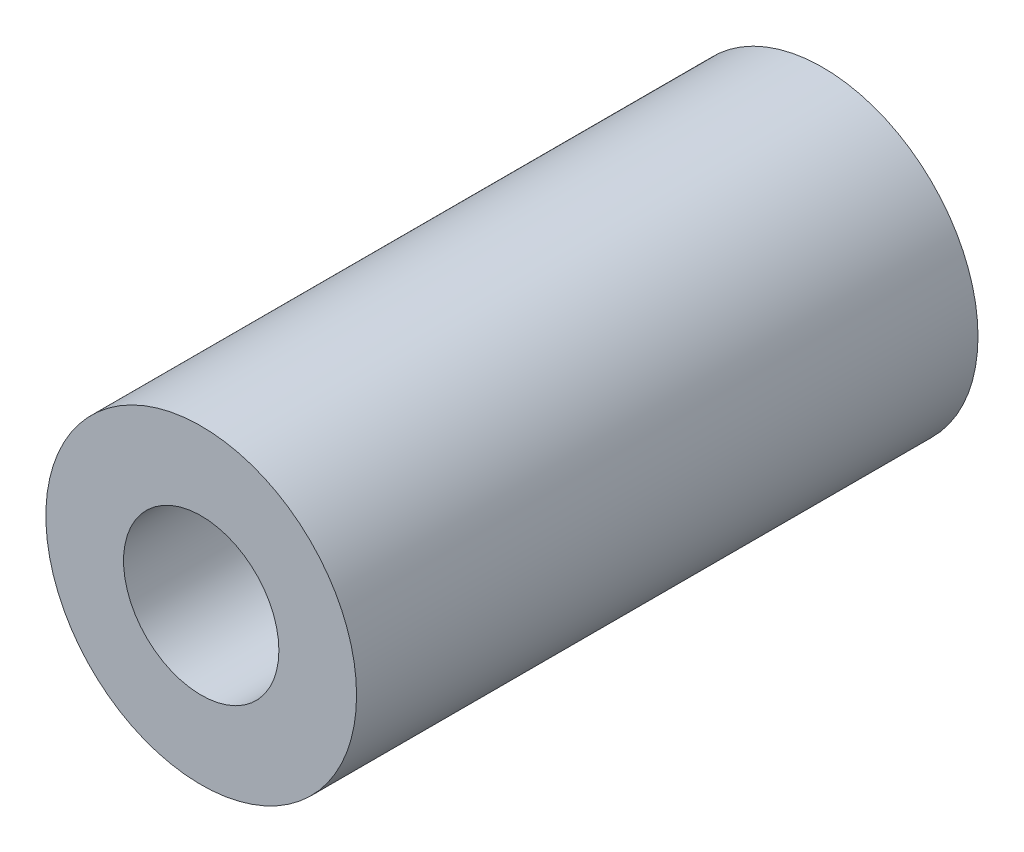
from build123d import *

# Parameters (mm, degrees)
SKETCH_1_R      = 3
SKETCH_1_R_2    = 1.5
EXTRUDE_1_DEPTH = 12


with BuildPart() as part:
    # 草图1 → 凸台-拉伸1 (new body)
    with BuildSketch(Plane.XY):
        Circle(SKETCH_1_R)
        Circle(SKETCH_1_R_2, mode=Mode.SUBTRACT)
    extrude(amount=EXTRUDE_1_DEPTH)


solid = part.part
